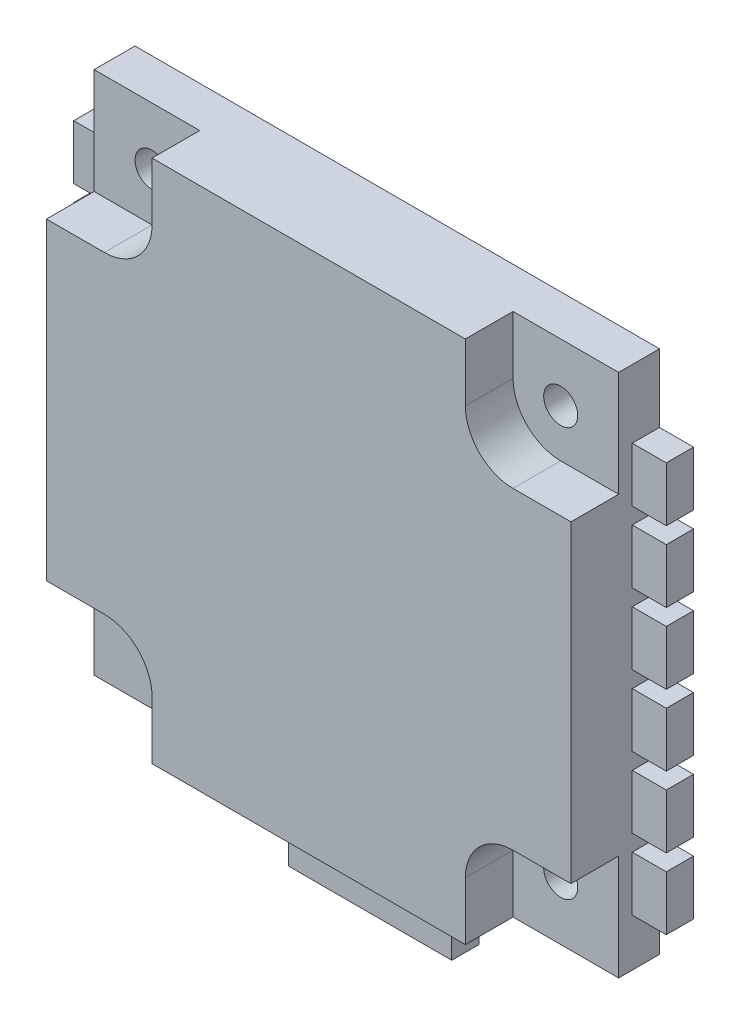
from build123d import *

# Parameters (mm, degrees)
SKETCH_1_W               = 38.5
SKETCH_1_H               = 38.5
EXTRUDE_1_DEPTH          = 6.5
SKETCH_2_W               = 2.5
SKETCH_2_H               = 4
SKETCH_2_W_2             = 6
SKETCH_2_H_2             = 6
EXTRUDE_2_DEPTH          = 2
M3X0_5_1_D               = 2.5
M3X0_5_1_DEPTH           = 7.748924226
M3X0_5_1_TIP             = 0.751075774
CUT_EXTRUDE_1_DEPTH      = 3.5
PATTERN_CIRCULAR_1_COUNT = 4


with BuildPart() as part:
    # ｽｹｯﾁ1 → ﾎﾞｽ - 押し出し1 (new body)
    with BuildSketch(Plane.XY):
        Rectangle(SKETCH_1_W, SKETCH_1_H)
    extrude(amount=EXTRUDE_1_DEPTH)

    # ｽｹｯﾁ2 → ﾎﾞｽ - 押し出し2 (add)
    with BuildSketch(Plane.XY):
        with Locations((-20.5, 12.25)):
            Rectangle(SKETCH_2_W, SKETCH_2_H)
        with Locations((-20.5, 7.05)):
            Rectangle(SKETCH_2_W, SKETCH_2_H)
        with Locations((-20.5, 1.85)):
            Rectangle(SKETCH_2_W, SKETCH_2_H)
        with Locations((-20.5, -3.35)):
            Rectangle(SKETCH_2_W, SKETCH_2_H)
        with Locations((-20.5, -8.55)):
            Rectangle(SKETCH_2_W, SKETCH_2_H)
        with Locations((-20.5, -13.75)):
            Rectangle(SKETCH_2_W, SKETCH_2_H)
        with Locations((-3, -22.25)):
            Rectangle(SKETCH_2_W_2, SKETCH_2_H_2)
        with Locations((3, -22.25)):
            Rectangle(SKETCH_2_W_2, SKETCH_2_H_2)
        with Locations((20.5, -13.75)):
            Rectangle(SKETCH_2_W, SKETCH_2_H)
        with Locations((20.5, -8.55)):
            Rectangle(SKETCH_2_W, SKETCH_2_H)
        with Locations((20.5, 1.85)):
            Rectangle(SKETCH_2_W, SKETCH_2_H)
        with Locations((20.5, 7.05)):
            Rectangle(SKETCH_2_W, SKETCH_2_H)
        with Locations((20.5, 12.25)):
            Rectangle(SKETCH_2_W, SKETCH_2_H)
        with Locations((20.5, -3.35)):
            Rectangle(SKETCH_2_W, SKETCH_2_H)
    extrude(amount=EXTRUDE_2_DEPTH)

    # M3x0.5 ねじ穴1
    with Locations(Plane.XY.offset(6.5)):
        with Locations((-15, 15), (15, 15), (15, -15), (-15, -15)):
            Hole(M3X0_5_1_D / 2, depth=M3X0_5_1_DEPTH)
            with Locations((0, 0, -(M3X0_5_1_DEPTH + M3X0_5_1_TIP / 2))):  # 118° drill point
                Cone(0, M3X0_5_1_D / 2, M3X0_5_1_TIP, mode=Mode.SUBTRACT)

    # ｽｹｯﾁ5 → ｶｯﾄ - 押し出し1 (cut)
    with BuildSketch(Plane.XY.offset(6.5)):
        with BuildLine():
            Line((-11.5, 15), (-11.5, 19.25))
            Line((-11.5, 19.25), (-19.25, 19.25))
            Line((-19.25, 19.25), (-19.25, 11.5))
            Line((-19.25, 11.5), (-15, 11.5))
            ThreePointArc((-15, 11.5), (-12.525126266, 12.525126266), (-11.5, 15))
        make_face()
    cut_extrude_1 = extrude(amount=-CUT_EXTRUDE_1_DEPTH, mode=Mode.SUBTRACT)

    # 円形ﾊﾟﾀｰﾝ1: ｶｯﾄ - 押し出し1 ×4 about axis
    pattern_circular_1_axis = Axis((0, 0, 0), (0, 0, 1))
    for i in range(1, PATTERN_CIRCULAR_1_COUNT):
        add(cut_extrude_1.rotate(pattern_circular_1_axis, i * 360 / PATTERN_CIRCULAR_1_COUNT), mode=Mode.SUBTRACT)


solid = part.part
